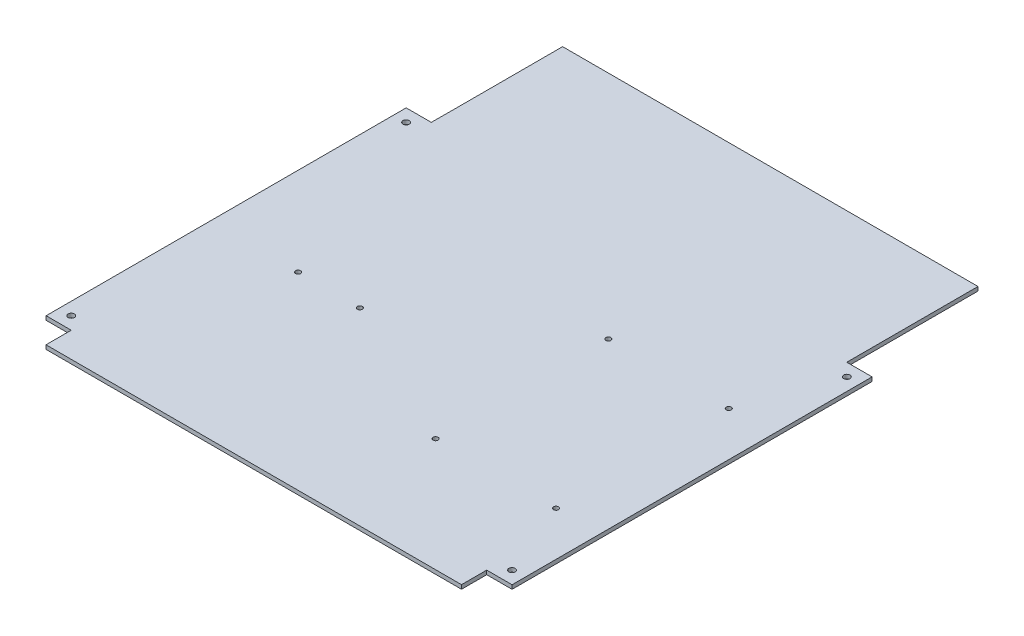
from build123d import *

# Parameters (mm, degrees)
BOSS_EXTRUDE1_DEPTH = 3.175
SKETCH4_R           = 2
CUT_EXTRUDE2_DEPTH  = 3.175
SKETCH7_W           = 20
SKETCH7_H           = 389.675
CUT_EXTRUDE6_DEPTH  = 3.175
SKETCH8_W           = 20.01
SKETCH8_H           = 84
SKETCH8_W_2         = 20.1
SKETCH8_H_2         = 84.09
CUT_EXTRUDE7_DEPTH  = 3.175
SKETCH9_R           = 2.5
CUT_EXTRUDE8_DEPTH  = 3.175


with BuildPart() as part:
    # Sketch1 → Boss-Extrude1 (new body)
    with BuildSketch(Plane(origin=(0, 0, 0), x_dir=(1, 0, 0), z_dir=(0, 1, 0))):
        Polygon((-165.06435994, -204.65564006), (-165.06435994, -184.65564006), (-204.97435994, -184.65564006), (-204.97435994, 100.92935994), (-165.06435994, 100.92935994), (-164.96435994, 121.01935994), (-204.97435994, 121.01935994), (-204.97435994, 205.01935994), (204.61064006, 205.01935994), (204.61064006, 121.01935994), (164.51064006, 120.92935994), (164.51064006, 100.92935994), (204.61064006, 100.92935994), (202.86064006, -184.65564006), (164.51064006, -184.65564006), (164.51064006, -204.65564006), align=None)
    extrude(amount=BOSS_EXTRUDE1_DEPTH)

    # Sketch4 → Cut-Extrude2 (cut)
    with BuildSketch(Plane(origin=(0, 3.175, 0), x_dir=(1, 0, 0), z_dir=(0, 1, 0))):
        with Locations(Location((-114.989359939, -54.80564006, 0), (0, 0, 270))):
            Circle(SKETCH4_R)
        with Locations(Location((-65.989359939, -54.80564006, 0), (0, 0, 270))):
            Circle(SKETCH4_R)
        with Locations(Location((54.010640061, -114.65564006, 0), (0, 0, 270))):
            Circle(SKETCH4_R)
        with Locations(Location((149.510640061, -114.65564006, 0), (0, 0, 270))):
            Circle(SKETCH4_R)
        with Locations(Location((54.010640061, 22.34435994, 0), (0, 0, 270))):
            Circle(SKETCH4_R)
        with Locations(Location((149.510640061, 22.34435994, 0), (0, 0, 270))):
            Circle(SKETCH4_R)
    extrude(amount=-CUT_EXTRUDE2_DEPTH, mode=Mode.SUBTRACT)

    # Sketch7 → Cut-Extrude6 (cut)
    with BuildSketch(Plane(origin=(0, 3.175, 0), x_dir=(1, 0, 0), z_dir=(0, 1, 0))):
        with Locations((-194.97435994, 10.18185994)):
            Rectangle(SKETCH7_W, SKETCH7_H)
        Polygon((204.61064006, 205.01935994), (184.61064006, 205.01935994), (184.61064006, -184.65564006), (202.86064006, -184.65564006), align=None)
    extrude(amount=-CUT_EXTRUDE6_DEPTH, mode=Mode.SUBTRACT)


with BuildPart() as body_2:
    # of the pieces the cut leaves, the one that is kept (cut_extrude6_keep)
    add(part.part.solids().sort_by_distance((-165.06435994, 0, 204.65564006))[0])

    # Sketch8 → Cut-Extrude7 (cut)
    with BuildSketch(Plane(origin=(0, 3.175, 0), x_dir=(1, 0, 0), z_dir=(0, 1, 0))):
        with Locations((-174.96935994, 163.01935994)):
            Rectangle(SKETCH8_W, SKETCH8_H)
        with Locations((174.56064006, 162.97435994)):
            Rectangle(SKETCH8_W_2, SKETCH8_H_2)
    extrude(amount=-CUT_EXTRUDE7_DEPTH, mode=Mode.SUBTRACT)

    # Sketch9 → Cut-Extrude8 (cut)
    with BuildSketch(Plane(origin=(0, 3.175, 0), x_dir=(1, 0, 0), z_dir=(0, 1, 0))):
        with Locations(Location((-175.01935994, -174.65564006, 0), (0, 0, 270))):
            Circle(SKETCH9_R)
        with Locations(Location((174.56064006, -174.65564006, 0), (0, 0, 270))):
            Circle(SKETCH9_R)
        with Locations(Location((174.56064006, 90.93435994, 0), (0, 0, 270))):
            Circle(SKETCH9_R)
        with Locations(Location((-175.01935994, 90.93435994, 0), (0, 0, 270))):
            Circle(SKETCH9_R)
    extrude(amount=-CUT_EXTRUDE8_DEPTH, mode=Mode.SUBTRACT)


solid = body_2.part
